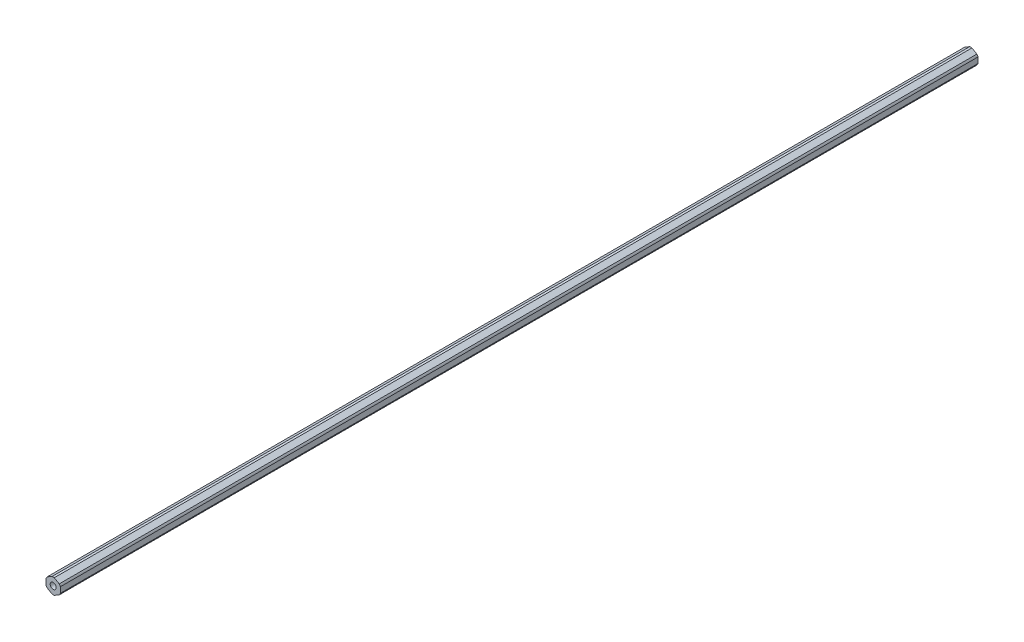
from build123d import *

# Parameters (mm, degrees)
SKETCH2_R                            = 2.0193
BOSS_EXTRUDE1_DEPTH                  = 304.8
F_10_32_TAPPED_HOLE2_D               = 4.0386
F_10_32_TAPPED_HOLE2_DEPTH           = 16.34744
F_10_32_TAPPED_HOLE2_TIP             = 1.213317848
F_10_32_TAPPED_HOLE2_ON_FACE_2_D     = 4.0386
F_10_32_TAPPED_HOLE2_ON_FACE_2_DEPTH = 16.34744
F_10_32_TAPPED_HOLE2_ON_FACE_2_TIP   = 1.213317848


with BuildPart() as part:
    # Sketch2 → Boss-Extrude1 (new, symmetric)
    with BuildSketch(Plane.XY):
        with BuildLine():
            ThreePointArc((0.741687758, 5.071047688), (0, 5.125000037), (-0.741687758, 5.071047688))
            Line((-0.741687758, 5.071047688), (-4.020812242, 3.177844283))
            ThreePointArc((-4.020812242, 3.177844283), (-4.438380226, 2.562500019), (-4.7625, 1.893203404))
            Line((-4.7625, 1.893203404), (-4.7625, -1.893203404))
            ThreePointArc((-4.7625, -1.893203404), (-4.438380226, -2.562500019), (-4.020812242, -3.177844283))
            Line((-4.020812242, -3.177844283), (-0.741687758, -5.071047688))
            ThreePointArc((-0.741687758, -5.071047688), (0, -5.125000037), (0.741687758, -5.071047688))
            Line((0.741687758, -5.071047688), (4.020812242, -3.177844283))
            ThreePointArc((4.020812242, -3.177844283), (4.438380226, -2.562500019), (4.7625, -1.893203404))
            Line((4.7625, -1.893203404), (4.7625, 1.893203404))
            ThreePointArc((4.7625, 1.893203404), (4.438380226, 2.562500019), (4.020812242, 3.177844283))
            Line((4.020812242, 3.177844283), (0.741687758, 5.071047688))
        make_face()
        with Locations(Location((0, 0, 0), (0, 0, 180))):
            Circle(SKETCH2_R, mode=Mode.SUBTRACT)
    extrude(amount=BOSS_EXTRUDE1_DEPTH, both=True)

    # #10-32 Tapped Hole2
    with Locations(Plane(origin=(0, 0, -304.8), x_dir=(-1, 0, 0), z_dir=(0, 0, -1))):
        with Locations((0, 0)):
            Hole(F_10_32_TAPPED_HOLE2_D / 2, depth=F_10_32_TAPPED_HOLE2_DEPTH)
            with Locations((0, 0, -(F_10_32_TAPPED_HOLE2_DEPTH + F_10_32_TAPPED_HOLE2_TIP / 2))):  # 118° drill point
                Cone(0, F_10_32_TAPPED_HOLE2_D / 2, F_10_32_TAPPED_HOLE2_TIP, mode=Mode.SUBTRACT)

    # #10-32 Tapped Hole2 on face 2
    with Locations(Plane(origin=(0, 0, 304.8), x_dir=(-1, 0, 0), z_dir=(0, 0, -1))):
        with Locations((0, 0)):
            Hole(F_10_32_TAPPED_HOLE2_ON_FACE_2_D / 2, depth=F_10_32_TAPPED_HOLE2_ON_FACE_2_DEPTH)
            with Locations((0, 0, -(F_10_32_TAPPED_HOLE2_ON_FACE_2_DEPTH + F_10_32_TAPPED_HOLE2_ON_FACE_2_TIP / 2))):  # 118° drill point
                Cone(0, F_10_32_TAPPED_HOLE2_ON_FACE_2_D / 2, F_10_32_TAPPED_HOLE2_ON_FACE_2_TIP, mode=Mode.SUBTRACT)


solid = part.part
